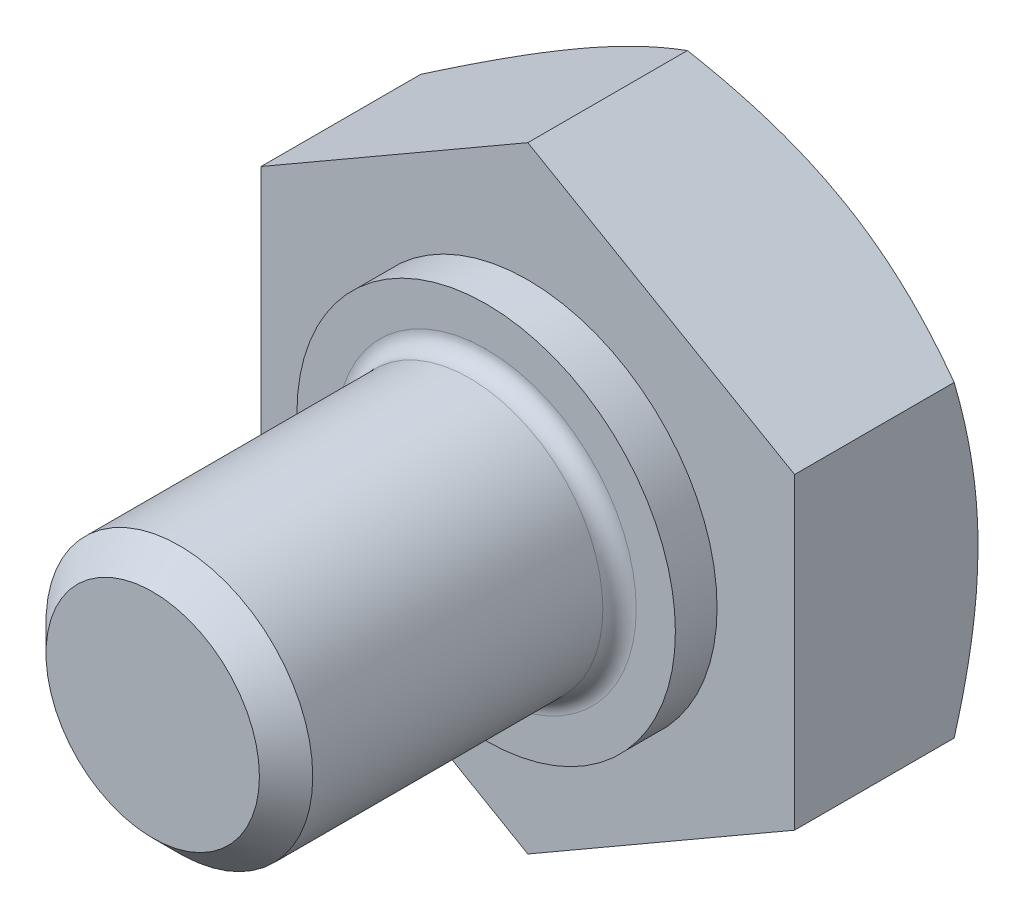
from build123d import *

# Parameters (mm, degrees)
VYSUNOUT1_DEPTH = 1.1
SKICA3_R        = 1.135
VYSUNOUT2_DEPTH = 0.25
SKICA4_R        = 0.8
VYSUNOUT3_DEPTH = 2
ZKOSIT1_SIZE    = 0.16
ZAOBLIT1_R      = 0.1


with BuildPart() as part:
    # Skica1 → Vysunout1 (new body)
    with BuildSketch(Plane.XY):
        Polygon((1.6, -0.923760431), (1.6, 0.923760431), (0, 1.847520861), (-1.6, 0.923760431), (-1.6, -0.923760431), (0, -1.847520861), align=None)
    extrude(amount=VYSUNOUT1_DEPTH)

    # Skica2 → Odebrat otočením1 (revolve, cut)
    with BuildSketch(Plane(origin=(0, 0, 0), x_dir=(1, 0, 0), z_dir=(0, 1, 0))):
        Polygon((1.6, 0), (3.505255888, 0), (3.505255888, -1.1), align=None)
    revolve(axis=Axis((0, 0, 0), (0, 0, 1)), mode=Mode.SUBTRACT)

    # Skica3 → Vysunout2 (add)
    with BuildSketch(Plane.XY.offset(1.1)):
        Circle(SKICA3_R)
    extrude(amount=VYSUNOUT2_DEPTH)

    # Skica4 → Vysunout3 (add)
    with BuildSketch(Plane.XY.offset(1.35)):
        Circle(SKICA4_R)
    extrude(amount=VYSUNOUT3_DEPTH)

    # Zkosit1
    zkosit1_edges = [part.edges().sort_by_distance(p)[0] for p in [
        (-0.8, 0, 3.35),
    ]]
    chamfer(zkosit1_edges, length=ZKOSIT1_SIZE)

    # Zaoblit1
    zaoblit1_edges = [part.edges().sort_by_distance(p)[0] for p in [
        (-0.8, 0, 1.35),
    ]]
    fillet(zaoblit1_edges, radius=ZAOBLIT1_R)


solid = part.part
